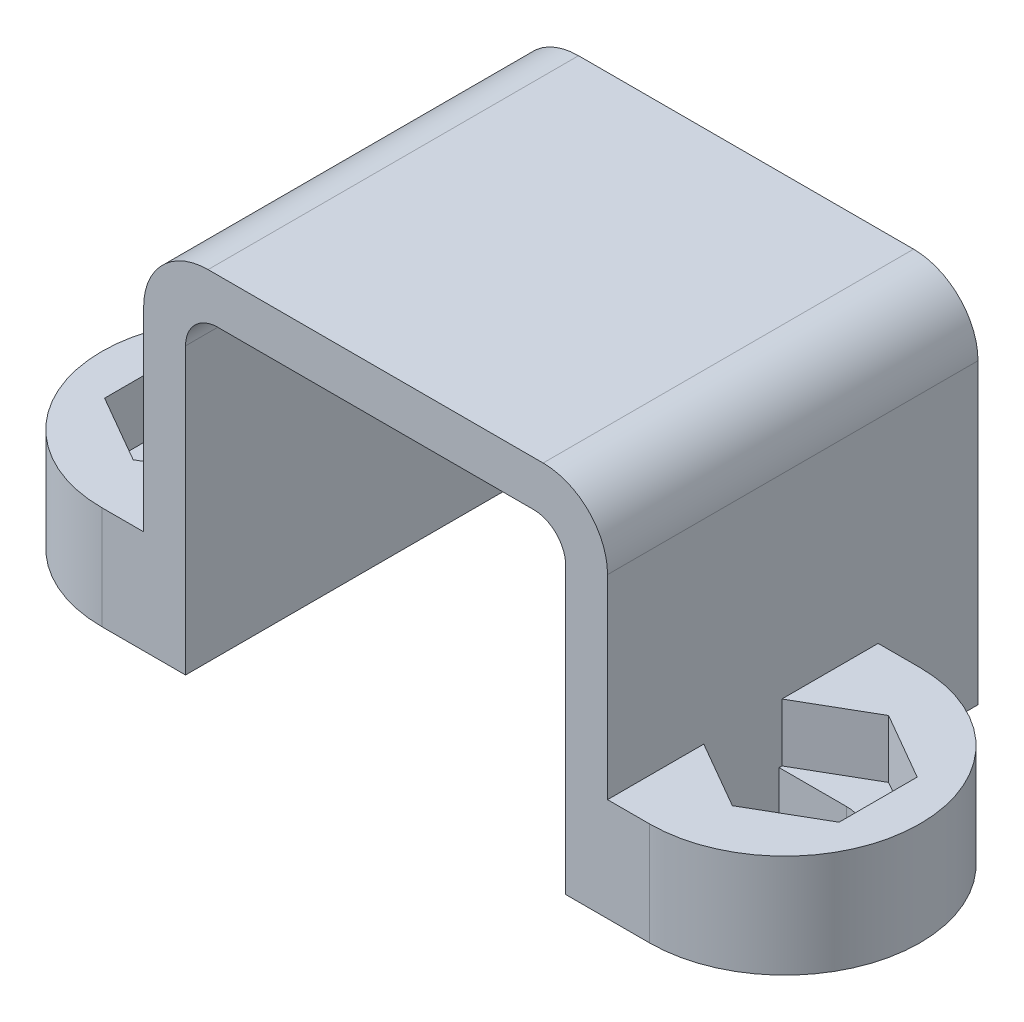
from build123d import *

# Parameters (mm, degrees)
EXTRUDE_1_DEPTH     = 11.5
CUT_EXTRUDE_1_DEPTH = 11.5
CUT_EXTRUDE_2_DEPTH = 11.5
CUT_EXTRUDE_3_DEPTH = 1.8
CUT_EXTRUDE_4_DEPTH = 1.8
CUT_EXTRUDE_5_DEPTH = 1.8
CUT_EXTRUDE_6_DEPTH = 1.8
FILLET_1_R          = 2
FILLET_2_R          = 2
FILLET_3_R          = 1
FILLET_4_R          = 1


with BuildPart() as part:
    # 草图1 → 凸台-拉伸1 (new body)
    with BuildSketch(Plane.XY):
        Polygon((14.4, 3.2), (14.4, 11.25), (0, 11.25), (0, 3.2), (-5.5, 3.2), (-5.5, 0), (0, 0), (1.3, 0), (1.3, 9.85), (13.1, 9.85), (13.1, 0), (14.4, 0), (19.9, 0), (19.9, 3.2), align=None)
    extrude(amount=EXTRUDE_1_DEPTH)

    # 草图2 → 切除-拉伸1 (cut)
    with BuildSketch(Plane(origin=(0, 3.2, 0), x_dir=(1, 0, 0), z_dir=(0, 1, 0))):
        with BuildLine():
            Line((14.4, 0), (14.4, -3.1))
            Line((14.4, -3.1), (15.7, -3.1))
            ThreePointArc((15.7, -3.1), (18.669848481, -4.330151519), (19.9, -7.3))
            Line((19.9, -7.3), (19.9, 0))
            Line((19.9, 0), (14.4, 0))
        make_face()
        with BuildLine():
            ThreePointArc((19.9, -7.3), (18.669848481, -10.269848481), (15.7, -11.5))
            Line((15.7, -11.5), (19.9, -11.5))
            Line((19.9, -11.5), (19.9, -7.3))
        make_face()
    extrude(amount=-CUT_EXTRUDE_1_DEPTH, mode=Mode.SUBTRACT)

    # 草图3 → 切除-拉伸2 (cut)
    with BuildSketch(Plane(origin=(0, 3.2, 0), x_dir=(1, 0, 0), z_dir=(0, 1, 0))):
        with BuildLine():
            Line((-1.3, -3.1), (0, -3.1))
            Line((0, -3.1), (0, 0))
            Line((0, 0), (-5.5, 0))
            Line((-5.5, 0), (-5.5, -7.3))
            ThreePointArc((-5.5, -7.3), (-4.269848481, -4.330151519), (-1.3, -3.1))
        make_face()
        with BuildLine():
            Line((-5.5, -11.5), (-1.3, -11.5))
            ThreePointArc((-1.3, -11.5), (-4.269848481, -10.269848481), (-5.5, -7.3))
            Line((-5.5, -7.3), (-5.5, -11.5))
        make_face()
    extrude(amount=-CUT_EXTRUDE_2_DEPTH, mode=Mode.SUBTRACT)

    # 草图5 → 切除-拉伸3 (cut)
    with BuildSketch(Plane(origin=(0, 3.2, 0), x_dir=(1, 0, 0), z_dir=(0, 1, 0))):
        Polygon((18.6, -6.087564435), (16.5, -4.875128869), (14.4, -6.087564435), (14.4, -8.512435565), (16.5, -9.724871131), (18.6, -8.512435565), align=None)
    extrude(amount=-CUT_EXTRUDE_3_DEPTH, mode=Mode.SUBTRACT)

    # 草图8 → 切除-拉伸4 (cut)
    with BuildSketch(Plane(origin=(0, 3.2, 0), x_dir=(1, 0, 0), z_dir=(0, 1, 0))):
        Polygon((-4.2, -6.087564435), (-4.2, -8.512435565), (-2.1, -9.724871131), (0, -8.512435565), (0, -6.087564435), (-2.1, -4.875128869), align=None)
    extrude(amount=-CUT_EXTRUDE_4_DEPTH, mode=Mode.SUBTRACT)

    # 草图10 → 切除-拉伸5 (cut)
    with BuildSketch(Plane(origin=(0, 1.4, 0), x_dir=(1, 0, 0), z_dir=(0, 1, 0))):
        with BuildLine():
            Line((0, -8.425), (0, -6.175))
            Line((0, -6.175), (-2.1, -6.175))
            ThreePointArc((-2.1, -6.175), (-3.225, -7.3), (-2.1, -8.425))
            Line((-2.1, -8.425), (0, -8.425))
        make_face()
    extrude(amount=-CUT_EXTRUDE_5_DEPTH, mode=Mode.SUBTRACT)

    # 草图7 → 切除-拉伸6 (cut)
    with BuildSketch(Plane(origin=(0, 1.4, 0), x_dir=(1, 0, 0), z_dir=(0, 1, 0))):
        with BuildLine():
            Line((14.4, -6.175), (14.4, -8.425))
            Line((14.4, -8.425), (16.5, -8.425))
            ThreePointArc((16.5, -8.425), (17.625, -7.3), (16.5, -6.175))
            Line((16.5, -6.175), (14.4, -6.175))
        make_face()
    extrude(amount=-CUT_EXTRUDE_6_DEPTH, mode=Mode.SUBTRACT)

    # 圆角1
    fillet_1_edges = [part.edges().sort_by_distance(p)[0] for p in [
        (0, 11.25, 5.75),
    ]]
    fillet(fillet_1_edges, radius=FILLET_1_R)

    # 圆角2
    fillet_2_edges = [part.edges().sort_by_distance(p)[0] for p in [
        (14.4, 11.25, 5.75),
    ]]
    fillet(fillet_2_edges, radius=FILLET_2_R)

    # 圆角3
    fillet_3_edges = [part.edges().sort_by_distance(p)[0] for p in [
        (1.3, 9.85, 5.75),
    ]]
    fillet(fillet_3_edges, radius=FILLET_3_R)

    # 圆角4
    fillet_4_edges = [part.edges().sort_by_distance(p)[0] for p in [
        (13.1, 9.85, 5.75),
    ]]
    fillet(fillet_4_edges, radius=FILLET_4_R)


solid = part.part
